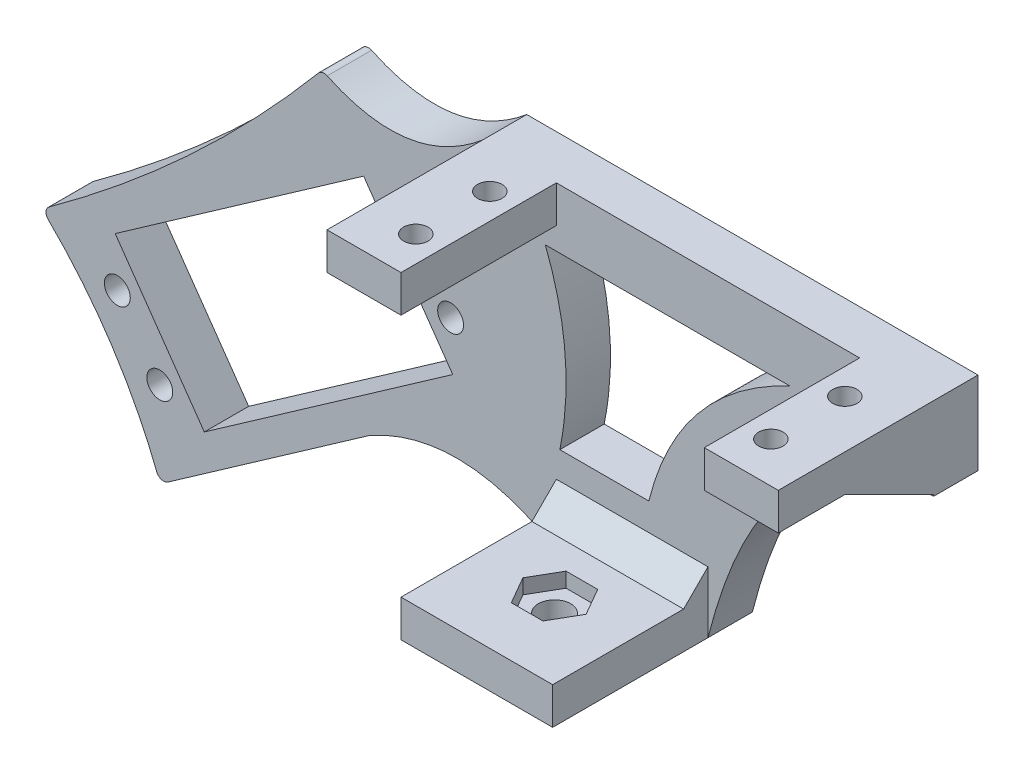
from build123d import *

# Parameters (mm, degrees)
SKETCH1_W             = 10
SKETCH1_H             = 5
BOSS_EXTRUDE1_DEPTH   = 21
BOSS_EXTRUDE1_2_DEPTH = 21
BOSS_EXTRUDE2_DEPTH   = 6
SKETCH3_W             = 20.5
SKETCH3_H             = 5
BOSS_EXTRUDE3_DEPTH   = 21
CUT_EXTRUDE1_REACH    = 64.414
SKETCH4_R             = 1.65
CUT_EXTRUDE2_REACH    = 61.08
SKETCH5_R             = 2.2
SKETCH6_R             = 1.75
BOSS_EXTRUDE4_DEPTH   = 6
CUT_EXTRUDE3_REACH    = 107.857
CUT_EXTRUDE7_REACH    = 109.208
BOSS_EXTRUDE5_DEPTH   = 6
BOSS_EXTRUDE6_DEPTH   = 3
BOSS_EXTRUDE7_DEPTH   = 3
BOSS_EXTRUDE8_DEPTH   = 20.5
SKETCH16_W            = 61.423716469
SKETCH16_H            = 45.352356837
CUT_EXTRUDE8_DEPTH    = 21
CUT_EXTRUDE9_DEPTH    = 6
FILLET1_R             = 1
CUT_EXTRUDE10_DEPTH   = 2


with BuildPart() as part:
    # Sketch1 → Boss-Extrude1 (new body)
    with BuildSketch(Plane.XY):
        with Locations((-31.296703297, 19.79010989)):
            Rectangle(SKETCH1_W, SKETCH1_H)
    boss_extrude1 = extrude(amount=BOSS_EXTRUDE1_DEPTH)



with BuildPart() as body_2:
    # Sketch1 → Boss-Extrude1 2 (new body)
    with BuildSketch(Plane.XY):
        with Locations((19.703296703, 19.79010989)):
            Rectangle(SKETCH1_W, SKETCH1_H)
    boss_extrude1_2 = extrude(amount=BOSS_EXTRUDE1_2_DEPTH)


with BuildPart() as part_1:
    add(part.part)

    add(body_2.part)  # Boss-Extrude2 merges body 2
    # Sketch2 → Boss-Extrude2 (add)
    with BuildSketch(Plane.XY.offset(21)):
        Polygon((-36.296703297, 22.29010989), (24.703296703, 22.29010989), (24.703296703, 7.29010989), (12.703296703, 7.29010989), (-5.796703297, -11.20989011), (-5.796703297, -20.70989011), (-36.296703297, -20.70989011), align=None)
    extrude(amount=BOSS_EXTRUDE2_DEPTH)

    # Sketch3 → Boss-Extrude3 (add)
    with BuildSketch(Plane(origin=(0, 0, 21), x_dir=(-1, 0, 0), z_dir=(0, 0, -1))):
        with Locations((16.046703297, -18.20989011)):
            Rectangle(SKETCH3_W, SKETCH3_H)
    boss_extrude3 = extrude(amount=BOSS_EXTRUDE3_DEPTH)

    # Sketch4 → Cut-Extrude1 (cut, up to next)
    with BuildSketch(Plane(origin=(0, 22.29010989, 0), x_dir=(1, 0, 0), z_dir=(0, 1, 0)), mode=Mode.PRIVATE) as cut_extrude1_sk1:
        with Locations(Location((-29.796703297, -5.5, 0), (0, 0, 270))):
            Circle(SKETCH4_R)
    cut_extrude1_tool1 = extrude(cut_extrude1_sk1.sketch, amount=-CUT_EXTRUDE1_REACH, mode=Mode.PRIVATE) & part_1.part
    # Sketch4 → Cut-Extrude1 (cut, up to next)
    with BuildSketch(Plane(origin=(0, 22.29010989, 0), x_dir=(1, 0, 0), z_dir=(0, 1, 0)), mode=Mode.PRIVATE) as cut_extrude1_sk2:
        with Locations(Location((18.203296703, -5.5, 0), (0, 0, 270))):
            Circle(SKETCH4_R)
    cut_extrude1_tool2 = extrude(cut_extrude1_sk2.sketch, amount=-CUT_EXTRUDE1_REACH, mode=Mode.PRIVATE) & part_1.part
    # Sketch4 → Cut-Extrude1 (cut, up to next)
    with BuildSketch(Plane(origin=(0, 22.29010989, 0), x_dir=(1, 0, 0), z_dir=(0, 1, 0)), mode=Mode.PRIVATE) as cut_extrude1_sk3:
        with Locations(Location((18.203296703, -15.5, 0), (0, 0, 270))):
            Circle(SKETCH4_R)
    cut_extrude1_tool3 = extrude(cut_extrude1_sk3.sketch, amount=-CUT_EXTRUDE1_REACH, mode=Mode.PRIVATE) & part_1.part
    # Sketch4 → Cut-Extrude1 (cut, up to next)
    with BuildSketch(Plane(origin=(0, 22.29010989, 0), x_dir=(1, 0, 0), z_dir=(0, 1, 0)), mode=Mode.PRIVATE) as cut_extrude1_sk4:
        with Locations(Location((-29.796703297, -15.5, 0), (0, 0, 270))):
            Circle(SKETCH4_R)
    cut_extrude1_tool4 = extrude(cut_extrude1_sk4.sketch, amount=-CUT_EXTRUDE1_REACH, mode=Mode.PRIVATE) & part_1.part
    cut_extrude1_1 = cut_extrude1_tool1.solids().sort_by_distance((-29.796703, 22.29011, 5.5))[0]
    add(cut_extrude1_1, mode=Mode.SUBTRACT)
    cut_extrude1_2 = cut_extrude1_tool2.solids().sort_by_distance((18.203297, 22.29011, 5.5))[0]
    add(cut_extrude1_2, mode=Mode.SUBTRACT)
    cut_extrude1_3 = cut_extrude1_tool3.solids().sort_by_distance((18.203297, 22.29011, 15.5))[0]
    add(cut_extrude1_3, mode=Mode.SUBTRACT)
    cut_extrude1_4 = cut_extrude1_tool4.solids().sort_by_distance((-29.796703, 22.29011, 15.5))[0]
    add(cut_extrude1_4, mode=Mode.SUBTRACT)
    cut_extrude1 = cut_extrude1_1 + cut_extrude1_2 + cut_extrude1_3 + cut_extrude1_4  # Cut-Extrude1 as one shape, for the pattern or mirror that repeats it

    # Sketch5 → Cut-Extrude2 (cut, up to next)
    with BuildSketch(Plane(origin=(0, -15.70989011, 0), x_dir=(1, 0, 0), z_dir=(0, 1, 0)), mode=Mode.PRIVATE) as cut_extrude2_sk1:
        with Locations(Location((-16.046703297, -10.5, 0), (0, 0, 270))):
            Circle(SKETCH5_R)
    cut_extrude2_tool1 = extrude(cut_extrude2_sk1.sketch, amount=-CUT_EXTRUDE2_REACH, mode=Mode.PRIVATE) & part_1.part
    cut_extrude2 = cut_extrude2_tool1.solids().sort_by_distance((-16.046703, -15.70989, 10.5))[0]
    add(cut_extrude2, mode=Mode.SUBTRACT)

    # Sketch6 → Boss-Extrude4 (add)
    with BuildSketch(Plane.XY.offset(27)):
        with BuildLine():
            Line((-79.859138265, -39.735236509), (-51.503727763, -19.880564327))
            add(Edge.make_bspline(
                [(-51.503727763, -19.880564327), (-43.777944292, -18.491061957), (-36.296703297, -20.70989011)],
                knots=[0, 0, 0, 1, 1, 1], degree=2))
            Line((-36.296703297, -20.70989011), (-36.296703297, 22.29010989))
            add(Edge.make_bspline(
                [(-57.962836939, 19.661219133), (-46.447122218, 13.814864777), (-36.296703297, 22.29010989)],
                knots=[0, 0, 0, 1, 1, 1], degree=2))
            add(Edge.make_bspline(
                [(-95.842115451, -15.524174544), (-74.663700283, -0.348148579), (-57.962836939, 19.661219133)],
                knots=[0, 0, 0, 1, 1, 1], degree=2))
            add(Edge.make_bspline(
                [(-95.842115451, -15.524174544), (-85.086697095, -25.754599345), (-79.859138265, -39.735236509)],
                knots=[0, 0, 0, 1, 1, 1], degree=2))
        make_face()
        with Locations((-40.590214383, -0.641481396)):
            Circle(SKETCH6_R, mode=Mode.SUBTRACT)
        with Locations((-85.645276872, -19.981629898)):
            Circle(SKETCH6_R, mode=Mode.SUBTRACT)
        with Locations((-79.909512508, -28.173150341)):
            Circle(SKETCH6_R, mode=Mode.SUBTRACT)
        with Locations((-46.325978746, 7.550039047)):
            Circle(SKETCH6_R, mode=Mode.SUBTRACT)
        Polygon((-85.932915117, -13.468776127), (-52.347681301, 10.047857763), (-40.302576138, -7.154335167), (-73.887809953, -30.670969058), align=None, mode=Mode.SUBTRACT)
    extrude(amount=-BOSS_EXTRUDE4_DEPTH)

    # Sketch7 → Cut-Extrude3 (cut, up to next)
    with BuildSketch(Plane(origin=(0, 0, 21), x_dir=(-1, 0, 0), z_dir=(0, 0, -1)), mode=Mode.PRIVATE) as cut_extrude3_sk1:
        with BuildLine():
            Line((36.296703297, -20.70989011), (26.296703297, -20.70989011))
            add(Edge.make_bspline(
                [(26.296703297, -20.70989011), (39.15974316, -13.056772406), (51.503727763, -19.880564327)],
                knots=[0, 0, 0, 1, 1, 1], degree=2))
            add(Edge.make_bspline(
                [(51.503727763, -19.880564327), (43.777944292, -18.491061957), (36.296703297, -20.70989011)],
                knots=[0, 0, 0, 1, 1, 1], degree=2))
        make_face()
    cut_extrude3_tool1 = extrude(cut_extrude3_sk1.sketch, amount=-CUT_EXTRUDE3_REACH, mode=Mode.PRIVATE) & part_1.part
    add(cut_extrude3_tool1.solids().sort_by_distance((-38.072503, -18.786508, 21))[0], mode=Mode.SUBTRACT)

    # Sketch10 → Cut-Extrude7 (cut, up to next)
    with BuildSketch(Plane.XY.offset(27), mode=Mode.PRIVATE) as cut_extrude7_sk1:
        with BuildLine():
            Line((5.266834936, 14.29010989), (-27.788194587, 14.29010989))
            add(Edge.make_bspline(
                [(-27.788194587, 14.29010989), (-23.431396766, 3.132914333), (-25.823714091, -8.70989011)],
                knots=[0, 0, 0, 1, 1, 1], degree=2))
            Line((-25.823714091, -8.70989011), (-13.796703297, -8.70989011))
            add(Edge.make_bspline(
                [(5.266834936, 14.29010989), (-9.842167425, 7.185288479), (-13.796703297, -8.70989011)],
                knots=[0, 0, 0, 1, 1, 1], degree=2))
        make_face()
    cut_extrude7_tool1 = extrude(cut_extrude7_sk1.sketch, amount=-CUT_EXTRUDE7_REACH, mode=Mode.PRIVATE) & part_1.part
    add(cut_extrude7_tool1.solids().sort_by_distance((-15.764918, 4.836925, 27))[0], mode=Mode.SUBTRACT)

    # Sketch11 → Boss-Extrude5 (add)
    with BuildSketch(Plane.XY.offset(27)):
        with BuildLine():
            Line((15.119169314, 7.29010989), (12.703296703, 7.29010989))
            Line((12.703296703, 7.29010989), (-5.796703297, -11.20989011))
            Line((-5.796703297, -11.20989011), (-5.796703297, -20.70989011))
            add(Edge.make_bspline(
                [(-5.796703297, -20.70989011), (-0.06692684, -3.022661062), (15.119169314, 7.29010989)],
                knots=[0, 0, 0, 1, 1, 1], degree=2))
        make_face()
    extrude(amount=-BOSS_EXTRUDE5_DEPTH)

    # Sketch12 → Boss-Extrude6 (add)
    with BuildSketch(Plane(origin=(24.703296703, 0, 0), x_dir=(0, 0, -1), z_dir=(1, 0, 0))):
        Polygon((-21, 11.29010989), (-9, 17.29010989), (-21, 17.29010989), align=None)
    boss_extrude6 = extrude(amount=-BOSS_EXTRUDE6_DEPTH)

    # Sketch13 → Boss-Extrude7 (add)
    with BuildSketch(Plane.ZY.offset(36.296703297)):
        Polygon((21, 11.29010989), (21, 17.29010989), (9, 17.29010989), align=None)
    boss_extrude7 = extrude(amount=-BOSS_EXTRUDE7_DEPTH)

    # Sketch14 → Boss-Extrude8 (add)
    with BuildSketch(Plane(origin=(-5.796703297, 0, 0), x_dir=(0, 0, -1), z_dir=(1, 0, 0))):
        Polygon((-17.7, -15.70989011), (-21, -12.40989011), (-21, -15.70989011), align=None)
    boss_extrude8 = extrude(amount=-BOSS_EXTRUDE8_DEPTH)

    # Mirror1: Boss-Extrude1, Boss-Extrude1 2, Boss-Extrude3, Cut-Extrude1, Cut-Extrude2, Boss-Extrude6, Boss-Extrude7, Boss-Extrude8 across plane
    add(boss_extrude1.mirror(Plane(origin=(0, 0, 24), x_dir=(1, 0, 0), z_dir=(0, 0, -1))))
    add(boss_extrude1_2.mirror(Plane(origin=(0, 0, 24), x_dir=(1, 0, 0), z_dir=(0, 0, -1))))
    add(boss_extrude3.mirror(Plane(origin=(0, 0, 24), x_dir=(1, 0, 0), z_dir=(0, 0, -1))))
    add(cut_extrude1.mirror(Plane(origin=(0, 0, 24), x_dir=(1, 0, 0), z_dir=(0, 0, -1))), mode=Mode.SUBTRACT)
    add(cut_extrude2.mirror(Plane(origin=(0, 0, 24), x_dir=(1, 0, 0), z_dir=(0, 0, -1))), mode=Mode.SUBTRACT)
    add(boss_extrude6.mirror(Plane(origin=(0, 0, 24), x_dir=(1, 0, 0), z_dir=(0, 0, -1))))
    add(boss_extrude7.mirror(Plane(origin=(0, 0, 24), x_dir=(1, 0, 0), z_dir=(0, 0, -1))))
    add(boss_extrude8.mirror(Plane(origin=(0, 0, 24), x_dir=(1, 0, 0), z_dir=(0, 0, -1))))

    # Sketch16 → Cut-Extrude8 (cut)
    with BuildSketch(Plane(origin=(0, 0, 0), x_dir=(-1, 0, 0), z_dir=(0, 0, -1))):
        with Locations((6.008561531, -0.386068529)):
            Rectangle(SKETCH16_W, SKETCH16_H)
    extrude(amount=-CUT_EXTRUDE8_DEPTH, mode=Mode.SUBTRACT)

    # Sketch17 → Cut-Extrude9 (cut)
    with BuildSketch(Plane(origin=(0, 0, 21), x_dir=(-1, 0, 0), z_dir=(0, 0, -1))):
        with BuildLine():
            Line((-24.703296703, 7.29010989), (-24.703296703, 11.09010989))
            add(Edge.make_bspline(
                [(5.796703297, -20.70989011), (-1.890928929, 9.845343686), (-24.703296703, 11.09010989)],
                knots=[0, 0, 0, 1, 1, 1], degree=2))
            add(Edge.make_bspline(
                [(5.796703297, -20.70989011), (0.06692684, -3.022661062), (-15.119169314, 7.29010989)],
                knots=[0, 0, 0, 1, 1, 1], degree=2))
            Line((-15.119169314, 7.29010989), (-24.703296703, 7.29010989))
        make_face()
    extrude(amount=-CUT_EXTRUDE9_DEPTH, mode=Mode.SUBTRACT)

    # Fillet1
    fillet1_edges = [part_1.edges().sort_by_distance(p)[0] for p in [
        (-79.859138265, -39.735236509, 24),
        (-95.842115451, -15.524174544, 24),
        (-57.962836939, 19.661219133, 24),
    ]]
    fillet(fillet1_edges, radius=FILLET1_R)

    # Sketch18 → Cut-Extrude10 (cut)
    with BuildSketch(Plane(origin=(0, -15.70989011, 0), x_dir=(1, 0, 0), z_dir=(0, 1, 0))):
        Polygon((-18.182899293, -41.2), (-13.910507301, -41.2), (-11.774311305, -37.5), (-13.910507301, -33.8), (-18.182899293, -33.8), (-20.319095289, -37.5), align=None)
    extrude(amount=-CUT_EXTRUDE10_DEPTH, mode=Mode.SUBTRACT)


solid = part_1.part
